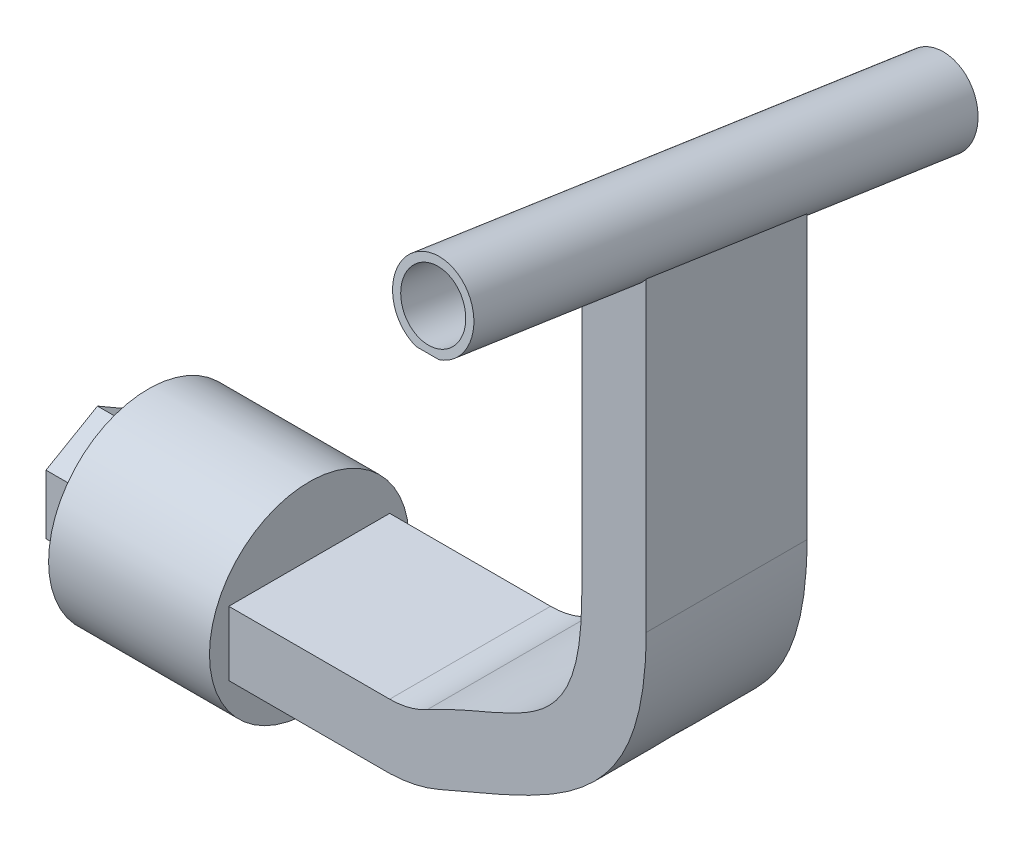
from build123d import *

# Parameters (mm, degrees)
BOSS_EXTRUDE1_DEPTH      = 127
SKETCH2_R                = 78.74
BOSS_EXTRUDE2_DEPTH      = 127
BOSS_EXTRUDE3_DEPTH      = 40.132
BOSS_EXTRUDE4_DEPTH      = 12.7
BOSS_EXTRUDE4_DEPTH_BACK = 63.5
CUT_EXTRUDE4_DEPTH       = 719.599431417
SKETCH7_R                = 25.4
CUT_EXTRUDE5_DEPTH       = 304.8
BOSS_EXTRUDE5_DEPTH      = 50.8
SKETCH9_R                = 25.4
CUT_EXTRUDE6_DEPTH       = 706.793572447
SKETCH10_R               = 28.426883493
BOSS_EXTRUDE6_DEPTH      = 152.4


with BuildPart() as part:
    # Sketch1 → Boss-Extrude1 (new body)
    with BuildSketch(Plane.XY):
        with BuildLine():
            Line((0, 0), (127, 0))
            ThreePointArc((127, 0), (146.783062772, 2.389452828), (165.763803889, 8.456620544))
            add(Edge.make_bspline(
                [(165.763803889, 8.456620544), (215.95075425, 29.910933142), (293.749967936, 60.02479605), (329.40949352, 131.409080947), (329.40949352, 197.581697377)],
                knots=[0, 0, 0, 0, 0.489737158, 1, 1, 1, 1], degree=3))
            Line((329.40949352, 197.581697377), (329.40949352, 431.8))
            Line((329.40949352, 431.8), (278.60949352, 431.8))
            Line((278.60949352, 431.8), (278.60949352, 197.581697377))
            add(Edge.make_bspline(
                [(156.630652755, 58.428868346), (189.028044031, 76.295644753), (253.765909659, 94.018996051), (278.60949352, 141.969854777), (278.60949352, 197.581697377)],
                knots=[0, 0, 0, 0, 0.475110131, 1, 1, 1, 1], degree=3))
            ThreePointArc((156.630652755, 58.428868346), (142.298490244, 52.737817604), (127, 50.8))
            Line((127, 50.8), (0, 50.8))
            Line((0, 50.8), (0, 0))
        make_face()
    extrude(amount=BOSS_EXTRUDE1_DEPTH)

    # Sketch2 → Boss-Extrude2 (add)
    with BuildSketch(Plane.ZY):
        with Locations((63.5, 25.4)):
            Circle(SKETCH2_R)
    extrude(amount=BOSS_EXTRUDE2_DEPTH)

    # Sketch3 → Boss-Extrude3 (add)
    with BuildSketch(Plane.ZY.offset(127)):
        Polygon((63.5, 72.32702988), (22.86, 48.86351494), (22.86, 1.93648506), (63.5, -21.52702988), (104.14, 1.93648506), (104.14, 48.86351494), align=None)
    extrude(amount=BOSS_EXTRUDE3_DEPTH)

    # Sketch4 → Boss-Extrude4 (add, two sides: drawn at the far end of the back side and taken through both)
    with BuildSketch(Plane.ZY.offset(-278.60949352).offset(-BOSS_EXTRUDE4_DEPTH_BACK)):
        Polygon((-123.979561218, 390.165409655), (273.996216856, 449.279655757), (262.901002007, 523.976146929), (-135.074776066, 464.861900827), align=None)
    extrude(amount=BOSS_EXTRUDE4_DEPTH + BOSS_EXTRUDE4_DEPTH_BACK)

    # Sketch6 → Cut-Extrude4 (cut, through all)
    with BuildSketch(Plane(origin=(0, -9.595531889, -64.600151761), x_dir=(-1, 0, 0), z_dir=(0, -0.14692530866024317, -0.9891475894299558))):
        with BuildLine():
            Line((-342.10949352, 404.146909738), (-312.773498747, 404.146909738))
            ThreePointArc((-312.773498747, 404.146909738), (-322.933498747, 460.026909738), (-272.133498747, 434.626909738))
            ThreePointArc((-272.133498747, 434.626909738), (-278.483498747, 415.576909738), (-294.993498747, 404.146909738))
            Line((-294.993498747, 404.146909738), (-265.90949352, 404.146909738))
            Line((-265.90949352, 404.146909738), (-265.90949352, 479.662931787))
            Line((-265.90949352, 479.662931787), (-342.10949352, 479.662931787))
            Line((-342.10949352, 479.662931787), (-342.10949352, 404.146909738))
        make_face()
    extrude(amount=-CUT_EXTRUDE4_DEPTH, mode=Mode.SUBTRACT)

    # Sketch7 → Cut-Extrude5 (cut)
    with BuildSketch(Plane(origin=(0, -9.595531889, -64.600151761), x_dir=(-1, 0, 0), z_dir=(0, -0.14692530866024317, -0.9891475894299558))):
        with Locations(Location((-303.883498747, 434.626909738, 0), (0, 0, 90))):
            Circle(SKETCH7_R)
    extrude(amount=-CUT_EXTRUDE5_DEPTH, mode=Mode.SUBTRACT)

    # Sketch8 → Boss-Extrude5 (add)
    with BuildSketch(Plane.ZY.offset(-278.60949352)):
        Polygon((0, 400.877395826), (0, 426.277395826), (127, 445.141632467), (127, 419.741632467), align=None)
    extrude(amount=-BOSS_EXTRUDE5_DEPTH)

    # Sketch9 → Cut-Extrude6 (cut, through all)
    with BuildSketch(Plane(origin=(0, -9.595531889, -64.600151761), x_dir=(-1, 0, 0), z_dir=(0, -0.14692530866024317, -0.9891475894299558))):
        with Locations(Location((-303.883498747, 434.626909738, 0), (0, 0, 90))):
            Circle(SKETCH9_R)
    extrude(amount=-CUT_EXTRUDE6_DEPTH, mode=Mode.SUBTRACT)

    # Sketch10 → Boss-Extrude6 (add)
    with BuildSketch(Plane(origin=(0, -9.595531889, -64.600151761), x_dir=(-1, 0, 0), z_dir=(0, -0.14692530866024317, -0.9891475894299558))):
        with Locations((-303.883498747, 434.626909738)):
            Circle(SKETCH10_R)
    extrude(amount=-BOSS_EXTRUDE6_DEPTH)


solid = part.part
